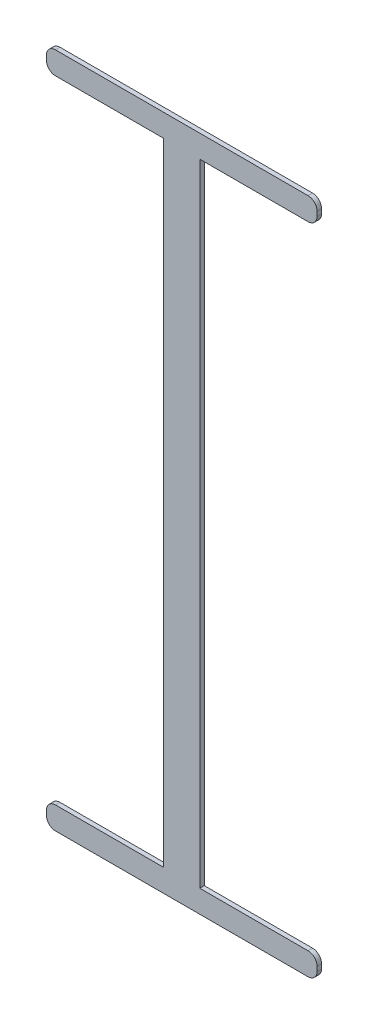
from build123d import *

# Parameters (mm, degrees)
EXTRUDE_1_DEPTH = 2


with BuildPart() as part:
    # 草图1 → 凸台-拉伸1 (new body)
    with BuildSketch(Plane.XY):
        with BuildLine():
            Line((-56, 150), (56, 150))
            ThreePointArc((56, 150), (58.828427125, 148.828427125), (60, 146))
            Line((60, 146), (60, 144))
            ThreePointArc((60, 144), (58.828427125, 141.171572875), (56, 140))
            Line((56, 140), (8, 140))
            Line((8, 140), (8, -140))
            Line((8, -140), (56, -140))
            ThreePointArc((56, -140), (58.828427125, -141.171572875), (60, -144))
            Line((60, -144), (60, -146))
            ThreePointArc((60, -146), (58.828427125, -148.828427125), (56, -150))
            Line((56, -150), (-56, -150))
            ThreePointArc((-56, -150), (-58.828427125, -148.828427125), (-60, -146))
            Line((-60, -146), (-60, -144))
            ThreePointArc((-60, -144), (-58.828427125, -141.171572875), (-56, -140))
            Line((-56, -140), (-8, -140))
            Line((-8, -140), (-8, 140))
            Line((-8, 140), (-56, 140))
            ThreePointArc((-56, 140), (-58.828427125, 141.171572875), (-60, 144))
            Line((-60, 144), (-60, 146))
            ThreePointArc((-60, 146), (-58.828427125, 148.828427125), (-56, 150))
        make_face()
    extrude(amount=EXTRUDE_1_DEPTH)


solid = part.part
